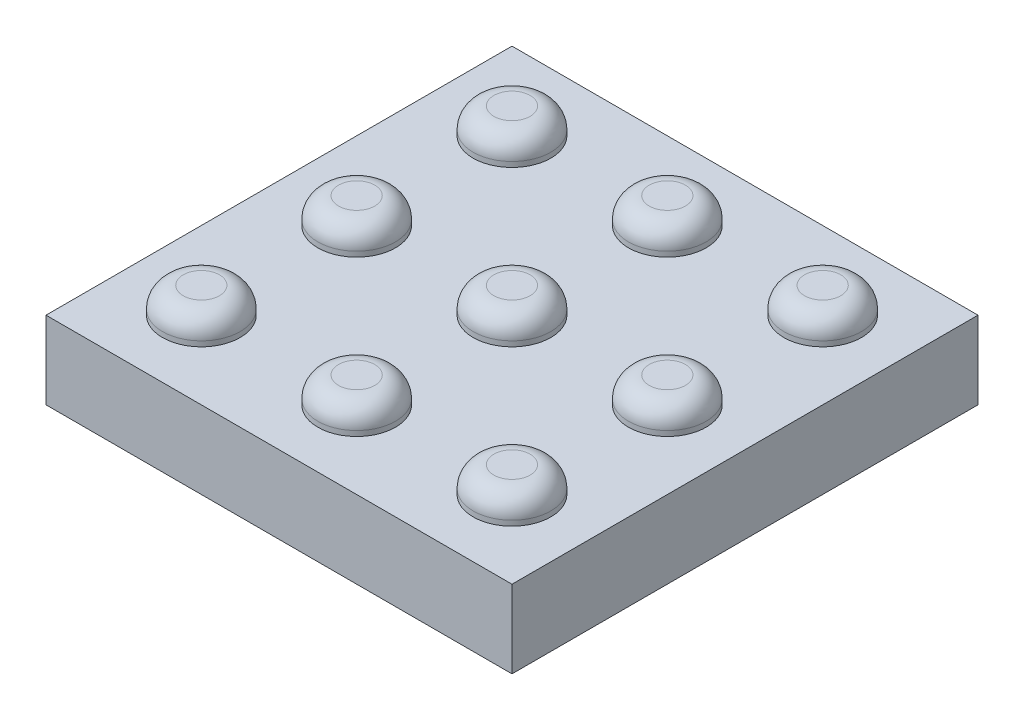
from build123d import *

# Parameters (mm, degrees)
SKETCH1_W           = 228.6
SKETCH1_H           = 228.6
BOSS_EXTRUDE1_DEPTH = 38.1
SKETCH1_3_R         = 19.05
BOSS_EXTRUDE2_DEPTH = 12.7
FILLET1_R           = 10.16


with BuildPart() as part:
    # Sketch1 → Boss-Extrude1 (new body)
    with BuildSketch(Plane(origin=(0, 0, 0), x_dir=(1, 0, 0), z_dir=(0, 1, 0))):
        with Locations((76.2, -76.2)):
            Rectangle(SKETCH1_W, SKETCH1_H)
    extrude(amount=-BOSS_EXTRUDE1_DEPTH)

    # Sketch1<3> → Boss-Extrude2 (add)
    with BuildSketch(Plane(origin=(0, 0, 0), x_dir=(1, 0, 0), z_dir=(0, 1, 0))):
        Circle(SKETCH1_3_R)
        with Locations((76.2, 0)):
            Circle(SKETCH1_3_R)
        with Locations((152.4, 0)):
            Circle(SKETCH1_3_R)
        with Locations((0, -76.2)):
            Circle(SKETCH1_3_R)
        with Locations((76.2, -76.2)):
            Circle(SKETCH1_3_R)
        with Locations((152.4, -76.2)):
            Circle(SKETCH1_3_R)
        with Locations((0, -152.4)):
            Circle(SKETCH1_3_R)
        with Locations((76.2, -152.4)):
            Circle(SKETCH1_3_R)
        with Locations((152.4, -152.4)):
            Circle(SKETCH1_3_R)
    extrude(amount=BOSS_EXTRUDE2_DEPTH)

    # Fillet1
    fillet1_edges = [part.edges().sort_by_distance(p)[0] for p in [
        (133.35, 12.7, 0),
        (133.35, 12.7, 76.2),
        (133.35, 12.7, 152.4),
        (57.15, 12.7, 152.4),
        (57.15, 12.7, 76.2),
        (57.15, 12.7, 0),
        (-19.05, 12.7, 0),
        (-19.05, 12.7, 76.2),
        (-19.05, 12.7, 152.4),
    ]]
    fillet(fillet1_edges, radius=FILLET1_R)


solid = part.part
